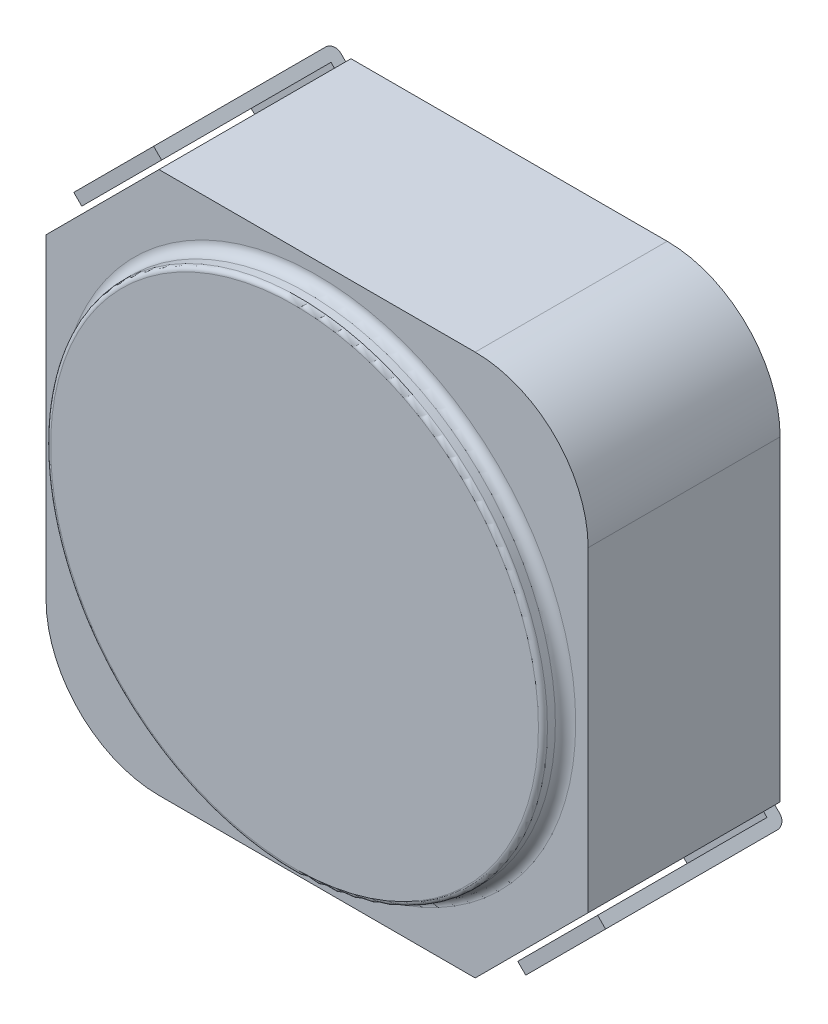
from build123d import *

# Parameters (mm, degrees)
EXTRUDE_START       = 0.1
EXTRUDE_1_DEPTH     = 1.7
SKETCH_6_R          = 2
CUT_EXTRUDE_5_DEPTH = 0.3
SKETCH_8_R          = 1.7
EXTRUDE_9_DEPTH     = 0.25
SKETCH_9_R          = 2.2
EXTRUDE_1_2_DEPTH   = 0.2
FILLET_2_R          = 0.09
FILLET_3_R          = 0.04
EXTRUDE_2_DEPTH     = 0.1
EXTRUDE_START_2     = 2.73
SKETCH_11_W         = 1.5
SKETCH_11_H         = 1
EXTRUDE_3_DEPTH     = 0.1
EXTRUDE_START_3     = -2.73
SKETCH_11_2_W       = 1.5
SKETCH_11_2_H       = 1
EXTRUDE_4_DEPTH     = 0.1
EXTRUDE_START_4     = 0.5
EXTRUDE_5_DEPTH     = 1


with BuildPart() as part:
    # Эскиз2 → Extrude 1 (new body)
    with BuildSketch(Plane.XY.offset(EXTRUDE_START)):
        with BuildLine():
            Line((-1.4, 2.4), (1.4, 2.4))
            ThreePointArc((1.4, 2.4), (2.107106781, 2.107106781), (2.4, 1.4))
            Line((2.4, 1.4), (2.4, -1.4))
            Line((2.4, -1.4), (1.4, -2.4))
            Line((1.4, -2.4), (-1.4, -2.4))
            ThreePointArc((-1.4, -2.4), (-2.107106781, -2.107106781), (-2.4, -1.4))
            Line((-2.4, -1.4), (-2.4, 1.4))
            Line((-2.4, 1.4), (-1.4, 2.4))
        make_face()
    extrude(amount=EXTRUDE_1_DEPTH)

    # Эскиз6 → Вытянуть5 (cut)
    with BuildSketch(Plane.XY):
        Circle(SKETCH_6_R)
    extrude(amount=CUT_EXTRUDE_5_DEPTH, mode=Mode.SUBTRACT)

    # Эскиз8 → Вытянуть9 (add)
    with BuildSketch(Plane.XY.offset(EXTRUDE_START)):
        Circle(SKETCH_8_R)
    extrude(amount=EXTRUDE_9_DEPTH)

    # Эскиз9 → Extrude 1 2 (add)
    with BuildSketch(Plane.XY.offset(1.8)):
        Circle(SKETCH_9_R)
    extrude(amount=EXTRUDE_1_2_DEPTH)

    # Скругление2
    fillet_2_edges = [part.edges().sort_by_distance(p)[0] for p in [
        (-2.2, 0, 1.8),
    ]]
    fillet(fillet_2_edges, radius=FILLET_2_R)

    # Скругление3
    fillet_3_edges = [part.edges().sort_by_distance(p)[0] for p in [
        (-2.2, 0, 2),
    ]]
    fillet(fillet_3_edges, radius=FILLET_3_R)

    # Эскиз10 → Бобышка-Вытянуть2 (add)
    with BuildSketch(Plane.XY):
        with BuildLine():
            Line((2.25, 0.75), (1.5, 0.75))
            ThreePointArc((1.5, 0.75), (0, 1.677050983), (-1.5, 0.75))
            Line((-1.5, 0.75), (-2.25, 0.75))
            Line((-2.25, 0.75), (-2.25, 1.55))
            Line((-2.25, 1.55), (-1.55, 2.25))
            Line((-1.55, 2.25), (1.5, 2.25))
            Line((1.5, 2.25), (2.25, 1.5))
            Line((2.25, 1.5), (2.25, 0.75))
        make_face()
        with BuildLine():
            Line((-2.25, -0.75), (-1.5, -0.75))
            ThreePointArc((-1.5, -0.75), (0, -1.677050983), (1.5, -0.75))
            Line((1.5, -0.75), (2.25, -0.75))
            Line((2.25, -0.75), (2.25, -1.55))
            Line((2.25, -1.55), (1.55, -2.25))
            Line((1.55, -2.25), (-1.5, -2.25))
            Line((-1.5, -2.25), (-2.25, -1.5))
            Line((-2.25, -1.5), (-2.25, -0.75))
        make_face()
    extrude(amount=EXTRUDE_2_DEPTH)



with BuildPart() as body_2:
    # Эскиз11 → Бобышка-Вытянуть3 (new body)
    with BuildSketch(Plane(origin=(0, 0, 0), x_dir=(0, 0, -1), z_dir=(0.7071067811865488, -0.7071067811865462, 0)).offset(EXTRUDE_START_2)):
        with Locations((-0.85, 0)):
            Rectangle(SKETCH_11_W, SKETCH_11_H)
    extrude(amount=EXTRUDE_3_DEPTH)


with BuildPart() as body_3:
    # Эскиз11<2> → Бобышка-Вытянуть4 (new body)
    with BuildSketch(Plane(origin=(0, 0, 0), x_dir=(0, 0, -1), z_dir=(0.7071067811865488, -0.7071067811865462, 0)).offset(EXTRUDE_START_3)):
        with Locations((-0.85, 0)):
            Rectangle(SKETCH_11_2_W, SKETCH_11_2_H)
    extrude(amount=-EXTRUDE_4_DEPTH)


with BuildPart() as part_1:
    add(part.part)

    add(body_2.part)  # Бобышка-Вытянуть5 merges body 2

    add(body_3.part)  # Бобышка-Вытянуть5 merges body 3
    # Эскиз12 → Бобышка-Вытянуть5 (add)
    with BuildSketch(Plane(origin=(0, 0, 0), x_dir=(0.7071067811865488, -0.7071067811865462, 0), z_dir=(-0.7071067811865462, -0.7071067811865488, 0)).offset(EXTRUDE_START_4)):
        with BuildLine():
            Line((2.83, 0.15), (2.83, 0.08))
            ThreePointArc((2.83, 0.08), (2.806568542, 0.023431458), (2.75, 0))
            Line((2.75, 0), (2.6, 0))
            Line((2.6, 0), (2.6, 0.1))
            Line((2.6, 0.1), (2.73, 0.1))
            Line((2.73, 0.1), (2.73, 0.15))
            Line((2.73, 0.15), (2.83, 0.15))
        make_face()
        with BuildLine():
            Line((-2.6, 0.1), (-2.6, 0))
            Line((-2.6, 0), (-2.75, 0))
            ThreePointArc((-2.75, 0), (-2.806568542, 0.023431458), (-2.83, 0.08))
            Line((-2.83, 0.08), (-2.83, 0.15))
            Line((-2.83, 0.15), (-2.73, 0.15))
            Line((-2.73, 0.15), (-2.73, 0.1))
            Line((-2.73, 0.1), (-2.6, 0.1))
        make_face()
    extrude(amount=-EXTRUDE_5_DEPTH)


solid = part_1.part
